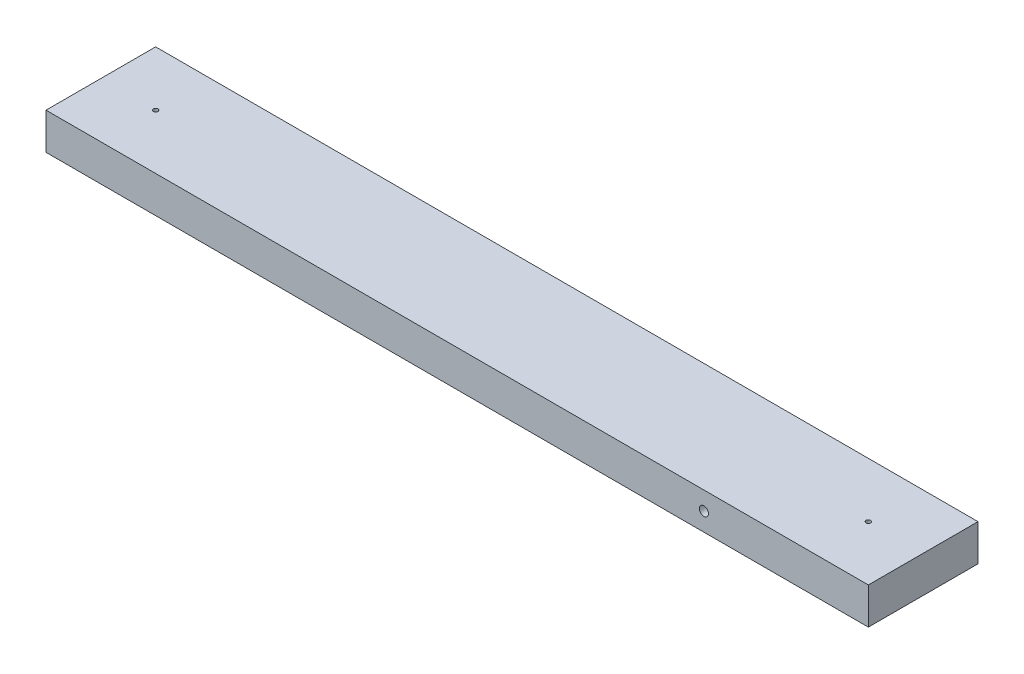
from build123d import *

# Parameters (mm, degrees)
SKETCH1_W           = 304.8
SKETCH1_H           = 101.6
BOSS_EXTRUDE1_DEPTH = 2286
SKETCH2_R           = 12.7
CUT_EXTRUDE1_DEPTH  = 304.8
SKETCH3_R           = 6.35
CUT_EXTRUDE2_DEPTH  = 101.6
SKETCH4_R           = 6.35
CUT_EXTRUDE3_DEPTH  = 101.6


with BuildPart() as part:
    # Sketch1 → Boss-Extrude1 (new body)
    with BuildSketch(Plane(origin=(0, 0, 0), x_dir=(0, 0, -1), z_dir=(1, 0, 0))):
        Rectangle(SKETCH1_W, SKETCH1_H)
    extrude(amount=BOSS_EXTRUDE1_DEPTH)

    # Sketch2 → Cut-Extrude1 (cut)
    with BuildSketch(Plane.XY.offset(152.4)):
        with Locations((1828.8, 0)):
            Circle(SKETCH2_R)
    extrude(amount=-CUT_EXTRUDE1_DEPTH, mode=Mode.SUBTRACT)

    # Sketch3 → Cut-Extrude2 (cut)
    with BuildSketch(Plane(origin=(0, 50.8, 0), x_dir=(1, 0, 0), z_dir=(0, 1, 0))):
        with Locations(Location((2133.6, 0, 0), (0, 0, 270))):
            Circle(SKETCH3_R)
    extrude(amount=-CUT_EXTRUDE2_DEPTH, mode=Mode.SUBTRACT)

    # Sketch4 → Cut-Extrude3 (cut)
    with BuildSketch(Plane.XZ.offset(50.8)):
        with Locations(Location((152.4, 0, 0), (0, 0, 270))):
            Circle(SKETCH4_R)
    extrude(amount=-CUT_EXTRUDE3_DEPTH, mode=Mode.SUBTRACT)


solid = part.part
